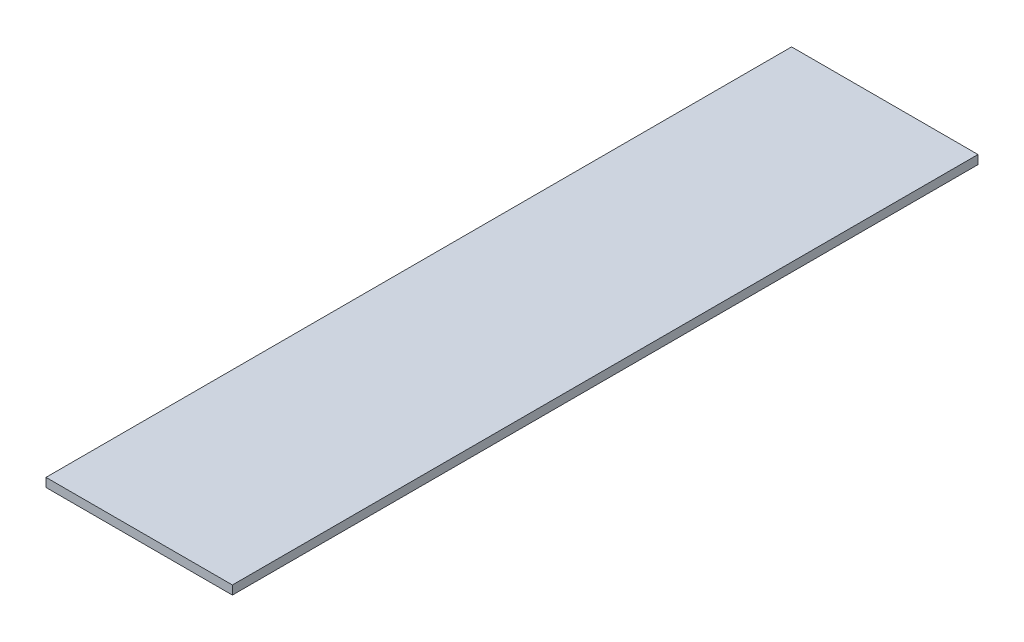
from build123d import *

# Parameters (mm, degrees)
SKETCH1_W           = 25
SKETCH1_H           = 100
BOSS_EXTRUDE1_DEPTH = 1.18


with BuildPart() as part:
    # Sketch1 → Boss-Extrude1 (new body)
    with BuildSketch(Plane(origin=(0, 0, 0), x_dir=(1, 0, 0), z_dir=(0, 1, 0))):
        Rectangle(SKETCH1_W, SKETCH1_H)
    extrude(amount=BOSS_EXTRUDE1_DEPTH)


solid = part.part
